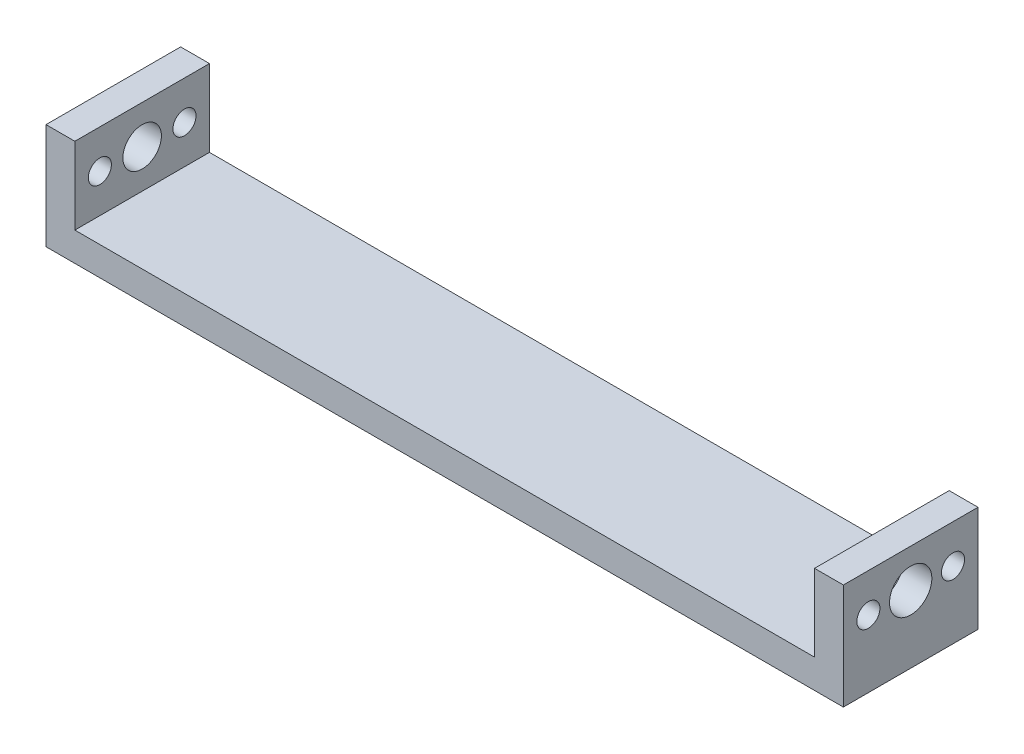
from build123d import *

# Parameters (mm, degrees)
BOSS_EXTRUDE3_DEPTH = 70
SKETCH2_R           = 10
CUT_EXTRUDE1_DEPTH  = 408.652008458
SKETCH3_R           = 6
CUT_EXTRUDE2_DEPTH  = 408.652008458
SKETCH4_R           = 11
CUT_EXTRUDE3_DEPTH  = 408.652008458
SKETCH5_R           = 6
CUT_EXTRUDE4_DEPTH  = 408.652008458


with BuildPart() as part:
    # Sketch1 → Boss-Extrude3 (new body)
    with BuildSketch(Plane.XY):
        Polygon((-207.952872216, 0), (176.647127784, 0), (176.647127784, 40), (191.647127784, 40), (191.647127784, 0), (191.647127784, -15), (-222.952872216, -15), (-222.952872216, 0), (-222.952872216, 40), (-207.952872216, 40), align=None)
    extrude(amount=BOSS_EXTRUDE3_DEPTH)

    # Sketch2 → Cut-Extrude1 (cut, through all)
    with BuildSketch(Plane(origin=(-207.952872216, 0, 0), x_dir=(0, 0, -1), z_dir=(1, 0, 0))):
        with Locations((-35, 20)):
            Circle(SKETCH2_R)
    extrude(amount=-CUT_EXTRUDE1_DEPTH, mode=Mode.SUBTRACT)

    # Sketch3 → Cut-Extrude2 (cut, through all)
    with BuildSketch(Plane(origin=(-207.952872216, 0, 0), x_dir=(0, 0, -1), z_dir=(1, 0, 0))):
        with Locations((-13, 20)):
            Circle(SKETCH3_R)
        with Locations((-57, 20)):
            Circle(SKETCH3_R)
    extrude(amount=-CUT_EXTRUDE2_DEPTH, mode=Mode.SUBTRACT)

    # Sketch4 → Cut-Extrude3 (cut, through all)
    with BuildSketch(Plane.ZY.offset(-176.647127784)):
        with Locations((35, 20)):
            Circle(SKETCH4_R)
    extrude(amount=-CUT_EXTRUDE3_DEPTH, mode=Mode.SUBTRACT)

    # Sketch5 → Cut-Extrude4 (cut, through all)
    with BuildSketch(Plane.ZY.offset(-176.647127784)):
        with Locations(Location((57, 20, 0), (0, 0, 180))):
            Circle(SKETCH5_R)
        with Locations(Location((13, 20, 0), (0, 0, 180))):
            Circle(SKETCH5_R)
    extrude(amount=-CUT_EXTRUDE4_DEPTH, mode=Mode.SUBTRACT)


solid = part.part
